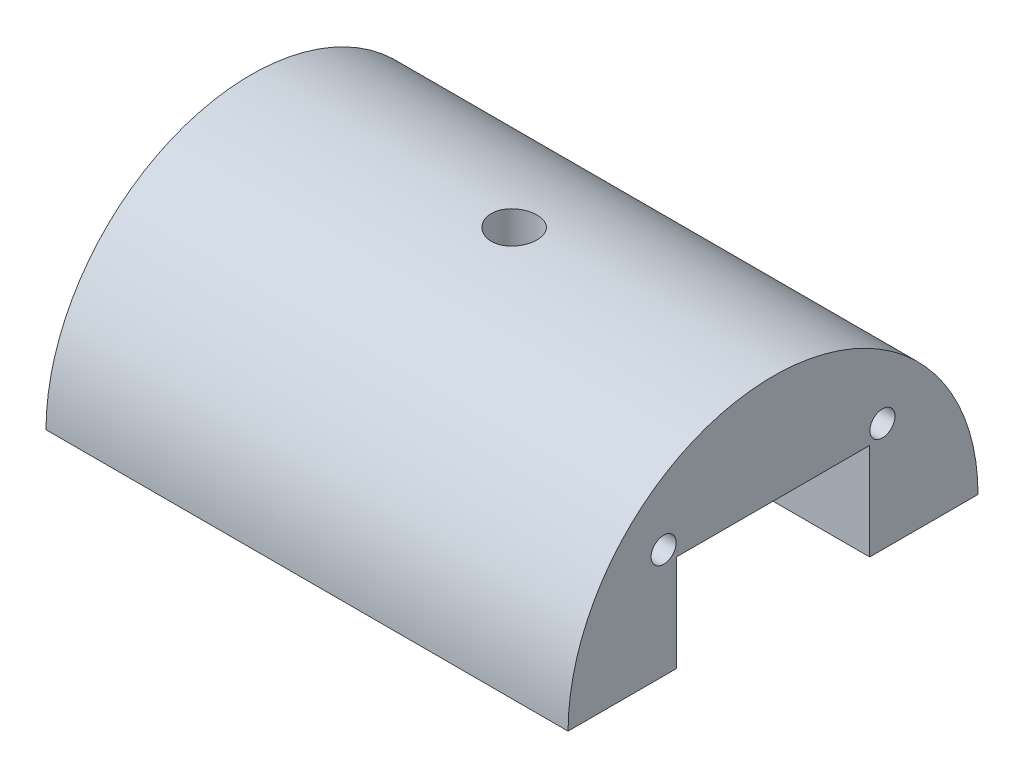
from build123d import *

# Parameters (mm, degrees)
SKETCH2_R               = 1.651
BOSS_EXTRUDE1_DEPTH     = 68.58
CUT_EXTRUDE3_DEPTH      = 79.441187854
CUT_EXTRUDE3_DEPTH_BACK = 79.441187854
SKETCH3_R               = 3


with BuildPart() as part:
    # Sketch2 → Boss-Extrude1 (new body)
    with BuildSketch(Plane(origin=(0, 0, 0), x_dir=(0, 0, -1), z_dir=(1, 0, 0))):
        with BuildLine():
            Line((-12.7, 12.7), (12.7, 12.7))
            Line((12.7, 12.7), (12.7, 0))
            Line((12.7, 0), (26.924, 0))
            ThreePointArc((26.924, 0), (0, 26.924), (-26.924, 0))
            Line((-26.924, 0), (-12.7, 0))
            Line((-12.7, 0), (-12.7, 12.7))
        make_face()
        with Locations((14.368409794, 14.368409794)):
            Circle(SKETCH2_R, mode=Mode.SUBTRACT)
        with Locations((-14.368409794, 14.368409794)):
            Circle(SKETCH2_R, mode=Mode.SUBTRACT)
    extrude(amount=BOSS_EXTRUDE1_DEPTH)

    # Sketch3 → Cut-Extrude3 (cut, two sides: drawn at the far end of the back side and taken through both)
    with BuildSketch(Plane(origin=(0, 0, 0), x_dir=(1, 0, 0), z_dir=(0, 1, 0)).offset(-CUT_EXTRUDE3_DEPTH_BACK)):
        with Locations(Location((34.57387325, 0, 0), (0, 0, 180))):
            Circle(SKETCH3_R)
    extrude(amount=CUT_EXTRUDE3_DEPTH + CUT_EXTRUDE3_DEPTH_BACK, mode=Mode.SUBTRACT)


solid = part.part
